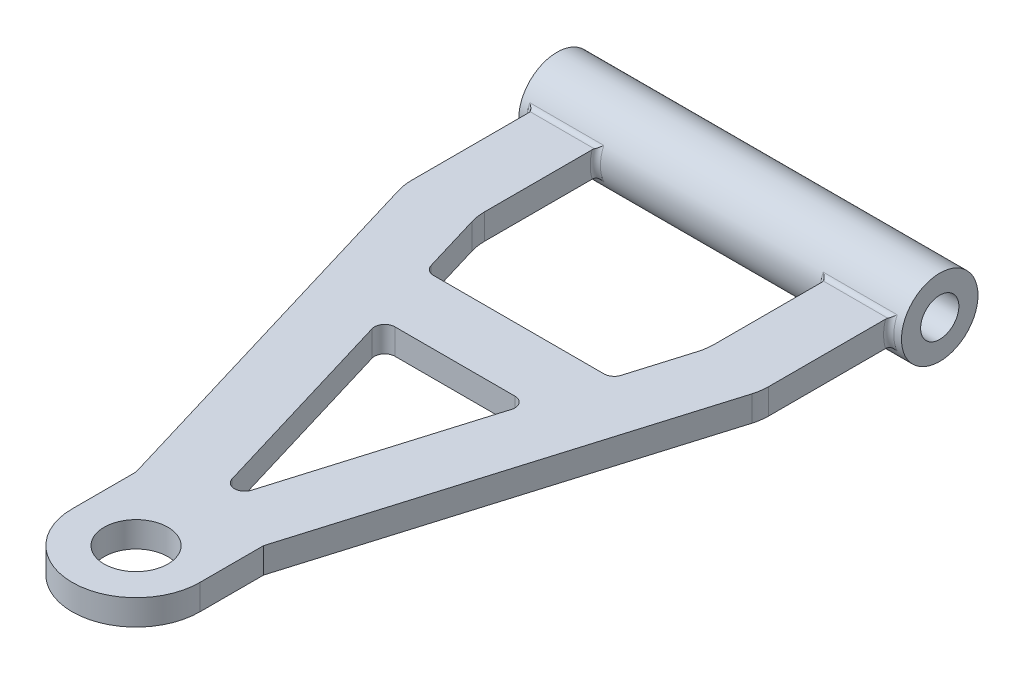
from build123d import *

# Parameters (mm, degrees)
SKETCH_1_R      = 15
SKETCH_1_R_2    = 7.5
EXTRUDE_1_DEPTH = 75
SKETCH_2_R      = 12.5
EXTRUDE_2_DEPTH = 5
FILLET_1_R      = 4
FILLET_2_R      = 20
FILLET_3_R      = 2


with BuildPart() as part:
    # 스케치1 → 보스-돌출1 (new, symmetric)
    with BuildSketch(Plane(origin=(0, 0, 0), x_dir=(0, 0, -1), z_dir=(1, 0, 0))):
        Circle(SKETCH_1_R)
        Circle(SKETCH_1_R_2, mode=Mode.SUBTRACT)
    extrude(amount=EXTRUDE_1_DEPTH, both=True)

    # 스케치2 → 보스-돌출2 (add, symmetric)
    with BuildSketch(Plane(origin=(0, 0, 0), x_dir=(1, 0, 0), z_dir=(0, 1, 0))):
        with BuildLine():
            Line((-70, -65), (-25, -215))
            Line((-25, -215), (-25, -240))
            ThreePointArc((-25, -240), (0, -265), (25, -240))
            Line((25, -240), (25, -215))
            Line((25, -215), (70, -65))
            Line((70, -65), (70, -12))
            Line((70, -12), (45, -12))
            Line((45, -12), (45, -61.330779092))
            Line((45, -61.330779092), (36.399233728, -90))
            Line((36.399233728, -90), (-36.399233728, -90))
            Line((-36.399233728, -90), (-45, -61.330779092))
            Line((-45, -61.330779092), (-45, -12))
            Line((-45, -12), (-70, -12))
            Line((-70, -12), (-70, -65))
        make_face()
        with Locations(Location((0, -240, 0), (0, 0, 270))):
            Circle(SKETCH_2_R, mode=Mode.SUBTRACT)
        with BuildLine():
            Line((3.831305141, -198.559761956), (28.899233728, -115))
            Line((28.899233728, -115), (-28.899233728, -115))
            Line((-28.899233728, -115), (-3.831305141, -198.559761956))
            ThreePointArc((-3.831305141, -198.559761956), (0, -201.410370414), (3.831305141, -198.559761956))
        make_face(mode=Mode.SUBTRACT)
    extrude(amount=EXTRUDE_2_DEPTH, both=True)

    # 필렛1
    fillet_1_edges = [part.edges().sort_by_distance(p)[0] for p in [
        (36.399233728, 0, 90),
        (-36.399233728, 0, 90),
        (28.899233728, 0, 115),
        (-28.899233728, 0, 115),
    ]]
    fillet(fillet_1_edges, radius=FILLET_1_R)

    # 필렛2
    fillet_2_edges = [part.edges().sort_by_distance(p)[0] for p in [
        (-70, 0, 65),
        (70, 0, 65),
        (45, 0, 61.330779092),
        (-45, 0, 61.330779092),
    ]]
    fillet(fillet_2_edges, radius=FILLET_2_R)

    # 필렛3
    fillet_3_edges = [part.edges().sort_by_distance(p)[0] for p in [
        (-45, 0, 15),
        (-57.5, -5, 14.142135624),
        (-57.5, 5, 14.142135624),
        (-70, 0, 15),
        (45, 0, 15),
        (57.5, -5, 14.142135624),
        (57.5, 5, 14.142135624),
        (70, 0, 15),
    ]]
    fillet(fillet_3_edges, radius=FILLET_3_R)


solid = part.part
